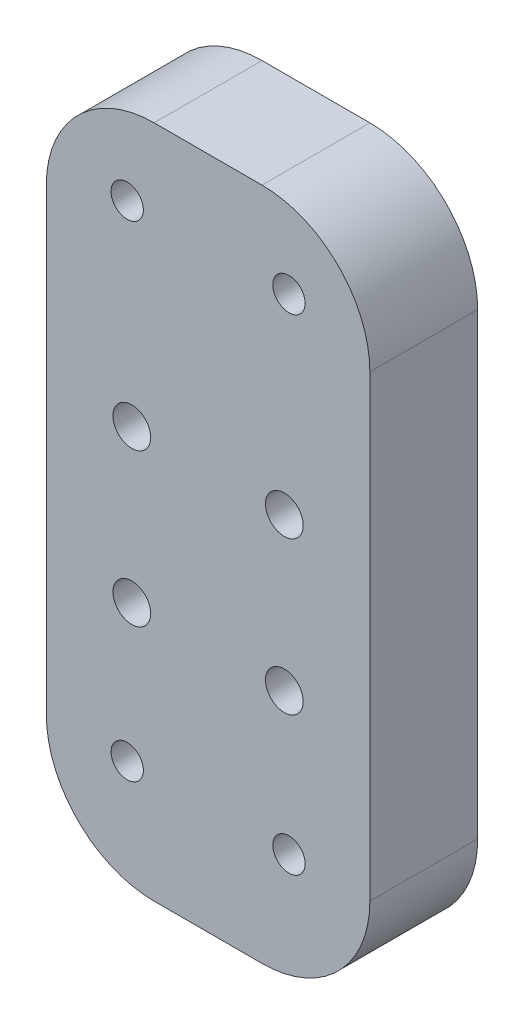
from build123d import *

# Parameters (mm, degrees)
SKETCH_1_W      = 30
SKETCH_1_H      = 62.5
SKETCH_1_R      = 1.75
SKETCH_1_R_2    = 1.5
EXTRUDE_1_DEPTH = 10
FILLET_1_R      = 10


with BuildPart() as part:
    # 草图1 → 凸台-拉伸1 (new body)
    with BuildSketch(Plane.XY):
        with Locations((0, 1.25)):
            Rectangle(SKETCH_1_W, SKETCH_1_H)
        with Locations((7.071067812, 7.071067812)):
            Circle(SKETCH_1_R, mode=Mode.SUBTRACT)
        with Locations((-7.071067812, 7.071067812)):
            Circle(SKETCH_1_R, mode=Mode.SUBTRACT)
        with Locations((7.071067812, -7.071067812)):
            Circle(SKETCH_1_R, mode=Mode.SUBTRACT)
        with Locations((-7.071067812, -7.071067812)):
            Circle(SKETCH_1_R, mode=Mode.SUBTRACT)
        with Locations((7.5, 25)):
            Circle(SKETCH_1_R_2, mode=Mode.SUBTRACT)
        with Locations((-7.5, 25)):
            Circle(SKETCH_1_R_2, mode=Mode.SUBTRACT)
        with Locations((7.5, -20)):
            Circle(SKETCH_1_R_2, mode=Mode.SUBTRACT)
        with Locations((-7.5, -20)):
            Circle(SKETCH_1_R_2, mode=Mode.SUBTRACT)
    extrude(amount=EXTRUDE_1_DEPTH)

    # 圆角1
    fillet_1_edges = [part.edges().sort_by_distance(p)[0] for p in [
        (15, -30, 5),
        (-15, -30, 5),
        (-15, 32.5, 5),
        (15, 32.5, 5),
    ]]
    fillet(fillet_1_edges, radius=FILLET_1_R)


solid = part.part
